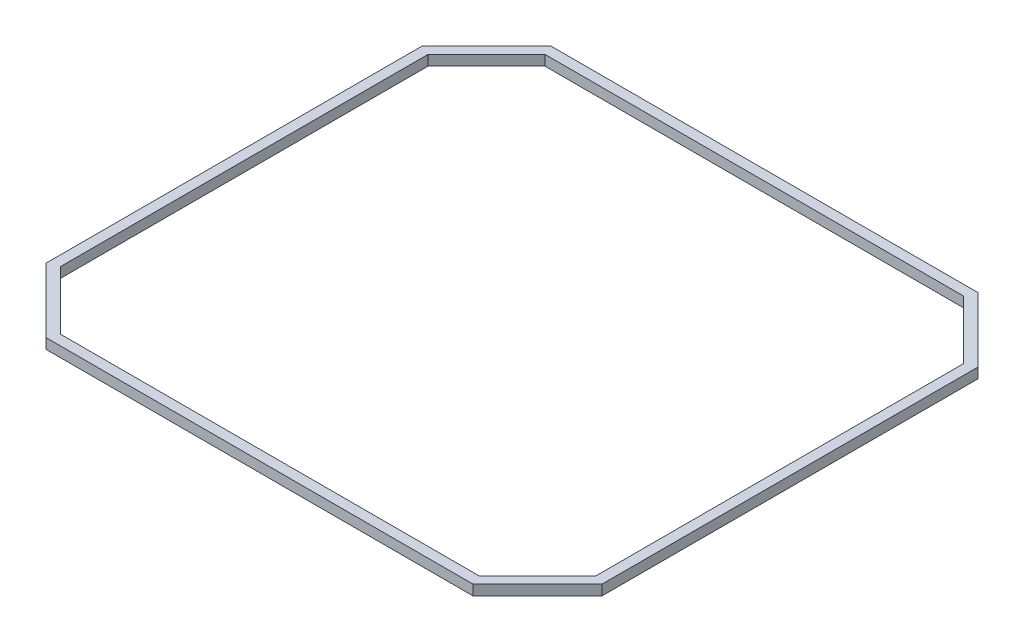
from build123d import *

# Parameters (mm, degrees)
SEAL_DEPTH = 2


with BuildPart() as part:
    # Seal Sketch → Seal (new body)
    with BuildSketch(Plane(origin=(0, 0, 0), x_dir=(1, 0, 0), z_dir=(0, 1, 0))):
        Polygon((-41.863961031, 49.5), (-54.5, 36.863961031), (-54.5, -36.863961031), (-41.863961031, -49.5), (41.863961031, -49.5), (54.5, -36.863961031), (54.5, 36.863961031), (41.863961031, 49.5), align=None)
        Polygon((-41.035533906, 47.5), (-52.5, 36.035533906), (-52.5, -36.035533906), (-41.035533906, -47.5), (41.035533906, -47.5), (52.5, -36.035533906), (52.5, 36.035533906), (41.035533906, 47.5), align=None, mode=Mode.SUBTRACT)
    extrude(amount=SEAL_DEPTH)


solid = part.part
